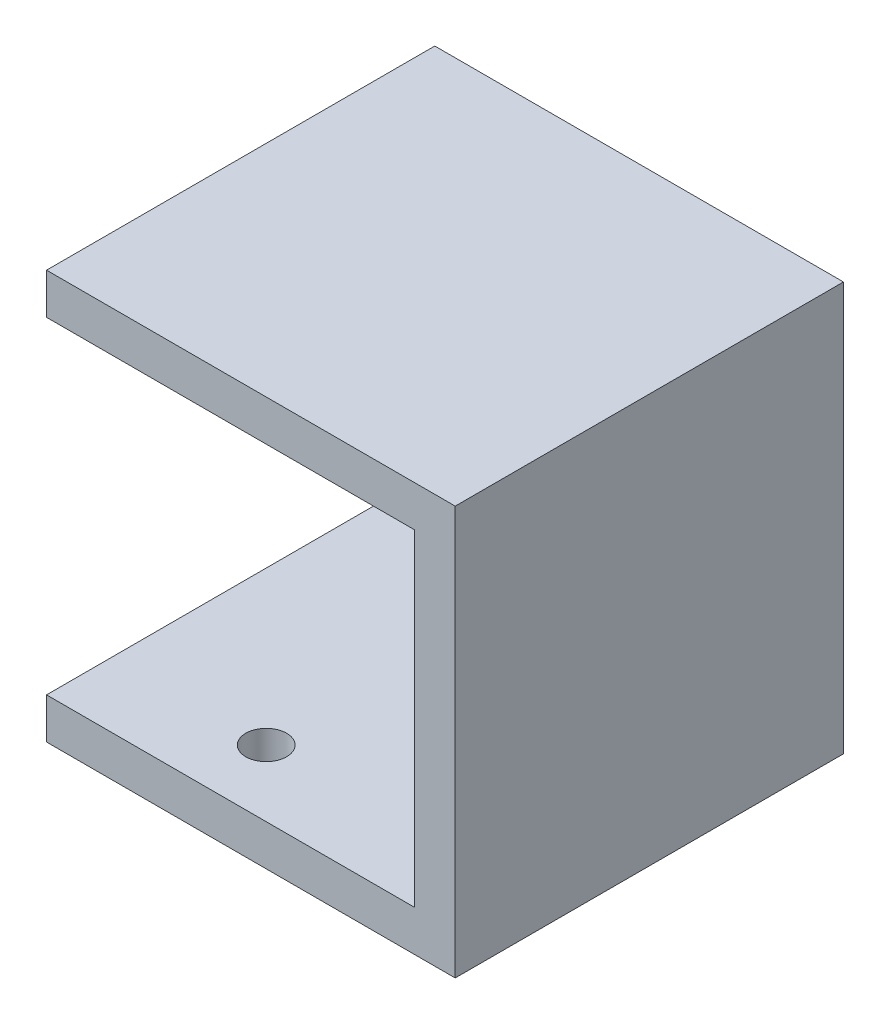
from build123d import *

# Parameters (mm, degrees)
BOSS_EXTRU_1_DEPTH      = 38
ESQUISSE2_R             = 2
ENL_V_MAT_EXTRU_1_DEPTH = 10


with BuildPart() as part:
    # Esquisse1 → Boss.-Extru.1 (new body)
    with BuildSketch(Plane.XY):
        Polygon((16, 34), (16, 18), (20, 18), (20, 38), (-20, 38), (-20, 34), align=None)
        Polygon((-20, 2), (-20, -2), (13.980877288, -2), (20, -2), (20, 2), (20, 18), (16, 18), (16, 2), align=None)
    extrude(amount=BOSS_EXTRU_1_DEPTH)

    # Esquisse2 → Enlèv. mat.-Extru.1 (cut)
    with BuildSketch(Plane.XZ.offset(2)):
        with Locations((-5, 31.5)):
            Circle(ESQUISSE2_R)
        with Locations((-5, 6.5)):
            Circle(ESQUISSE2_R)
    extrude(amount=-ENL_V_MAT_EXTRU_1_DEPTH, mode=Mode.SUBTRACT)


solid = part.part
